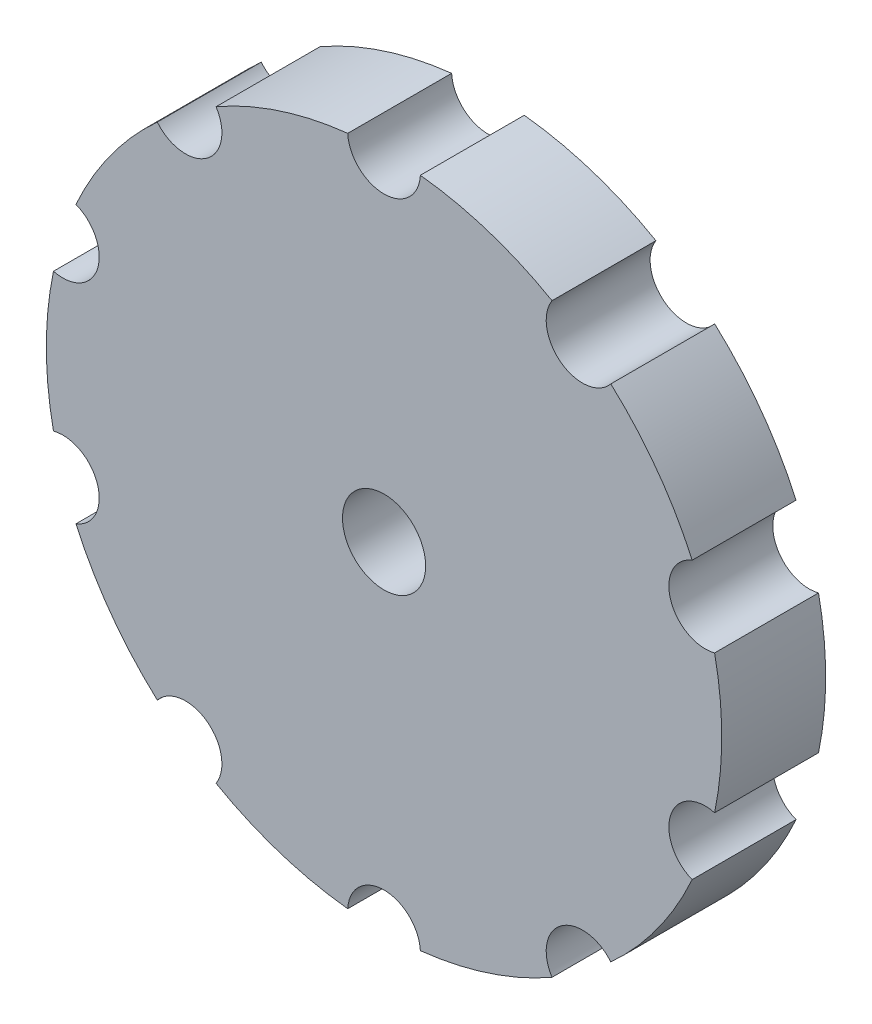
from build123d import *

# Parameters (mm, degrees)
CROQUIS1_R              = 4
SALIENTE_EXTRUIR1_DEPTH = 10


with BuildPart() as part:
    # Croquis1 → Saliente-Extruir1 (new body)
    with BuildSketch(Plane.XY):
        with BuildLine():
            ThreePointArc((-29.650108804, -13.308683176), (-27.580638973, -8.961492837), (-31.810089606, -6.660945822))
            ThreePointArc((-31.810089606, -6.660945822), (-32.5, 0), (-31.810089606, 6.660945822))
            ThreePointArc((-31.810089606, 6.660945822), (-27.580638973, 8.961492837), (-29.650108804, 13.308683176))
            ThreePointArc((-29.650108804, 13.308683176), (-26.293052317, 19.1030207), (-21.819697364, 24.086319913))
            ThreePointArc((-21.819697364, 24.086319913), (-17.045772316, 23.461492837), (-16.16479421, 28.194847546))
            ThreePointArc((-16.16479421, 28.194847546), (-10.043052317, 30.90933678), (-3.494922352, 32.311538462))
            ThreePointArc((-3.494922352, 32.311538462), (0, 29), (3.494922352, 32.311538462))
            ThreePointArc((3.494922352, 32.311538462), (10.043052317, 30.90933678), (16.16479421, 28.194847546))
            ThreePointArc((16.16479421, 28.194847546), (17.045772316, 23.461492837), (21.819697364, 24.086319913))
            ThreePointArc((21.819697364, 24.086319913), (26.293052317, 19.1030207), (29.650108804, 13.308683176))
            ThreePointArc((29.650108804, 13.308683176), (27.580638973, 8.961492837), (31.810089606, 6.660945822))
            ThreePointArc((31.810089606, 6.660945822), (32.5, 0), (31.810089606, -6.660945822))
            ThreePointArc((31.810089606, -6.660945822), (27.580638973, -8.961492837), (29.650108804, -13.308683176))
            ThreePointArc((29.650108804, -13.308683176), (26.293052317, -19.1030207), (21.819697364, -24.086319913))
            ThreePointArc((21.819697364, -24.086319913), (17.045772316, -23.461492837), (16.16479421, -28.194847546))
            ThreePointArc((16.16479421, -28.194847546), (10.043052317, -30.90933678), (3.494922352, -32.311538462))
            ThreePointArc((3.494922352, -32.311538462), (0, -29), (-3.494922352, -32.311538462))
            ThreePointArc((-3.494922352, -32.311538462), (-10.043052317, -30.90933678), (-16.16479421, -28.194847546))
            ThreePointArc((-16.16479421, -28.194847546), (-17.045772316, -23.461492837), (-21.819697364, -24.086319913))
            ThreePointArc((-21.819697364, -24.086319913), (-26.293052317, -19.1030207), (-29.650108804, -13.308683176))
        make_face()
        Circle(CROQUIS1_R, mode=Mode.SUBTRACT)
    extrude(amount=SALIENTE_EXTRUIR1_DEPTH)


solid = part.part
